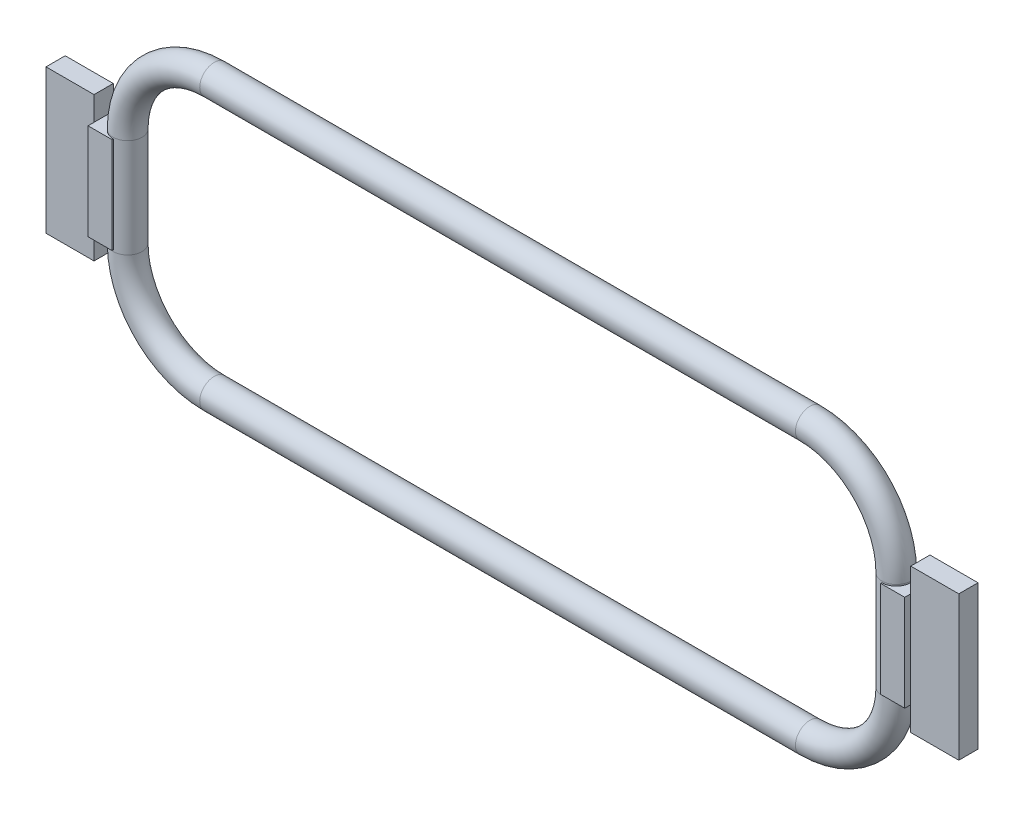
from build123d import *

# Parameters (mm, degrees)
SKETCH1_W           = 100
SKETCH1_H           = 75
SKETCH1_H_2         = 150
BOSS_EXTRUDE1_DEPTH = 20
SKETCH4_W           = 50
SKETCH4_H           = 150
BOSS_EXTRUDE3_DEPTH = 6.25
SKETCH5_W           = 50
SKETCH5_H           = 150
BOSS_EXTRUDE4_DEPTH = 6.25
SKETCH21_W          = 850
SKETCH21_H          = 32.5
CUT_EXTRUDE2_DEPTH  = 25
CUT_EXTRUDE3_START  = -150
SKETCH21_2_W        = 850
SKETCH21_2_H        = 32.5
CUT_EXTRUDE3_DEPTH  = 25
SWEEP1_PROFILE_R    = 15
CUT_EXTRUDE1_DEPTH  = 50


with BuildPart() as part:
    # Sketch1 → Boss-Extrude1 (new body)
    with BuildSketch(Plane.XY):
        with Locations((-850, 37.5)):
            Rectangle(SKETCH1_W, SKETCH1_H)
        with Locations((-850, -37.5)):
            Rectangle(SKETCH1_W, SKETCH1_H)
        Rectangle(SKETCH1_W, SKETCH1_H_2)
    extrude(amount=BOSS_EXTRUDE1_DEPTH)

    # Sketch4 → Boss-Extrude3 (add)
    with BuildSketch(Plane(origin=(0, 0, 0), x_dir=(-1, 0, 0), z_dir=(0, 0, -1))):
        with Locations((25, 0)):
            Rectangle(SKETCH4_W, SKETCH4_H)
        with Locations((825, 0)):
            Rectangle(SKETCH4_W, SKETCH4_H)
    extrude(amount=BOSS_EXTRUDE3_DEPTH)

    # Sketch5 → Boss-Extrude4 (add)
    with BuildSketch(Plane.XY.offset(20)):
        with Locations((-825, 0)):
            Rectangle(SKETCH5_W, SKETCH5_H)
        with Locations((-25, 0)):
            Rectangle(SKETCH5_W, SKETCH5_H)
    extrude(amount=BOSS_EXTRUDE4_DEPTH)

    # Sketch21 → Cut-Extrude2 (cut)
    with BuildSketch(Plane(origin=(0, 75, 0), x_dir=(1, 0, 0), z_dir=(0, 1, 0))):
        with Locations((-425, -10)):
            Rectangle(SKETCH21_W, SKETCH21_H)
    extrude(amount=-CUT_EXTRUDE2_DEPTH, mode=Mode.SUBTRACT)

    # Sketch21<2> → Cut-Extrude3 (cut)
    with BuildSketch(Plane(origin=(0, 75, 0), x_dir=(1, 0, 0), z_dir=(0, 1, 0)).offset(CUT_EXTRUDE3_START)):
        with Locations((-425, -10)):
            Rectangle(SKETCH21_2_W, SKETCH21_2_H)
    extrude(amount=CUT_EXTRUDE3_DEPTH, mode=Mode.SUBTRACT)

    # Sweep1: sweep along a path in Sketch6
    with BuildLine(Plane.XY.offset(10)) as sweep1_path:
        Line((-115, -141.504877042), (-735, -141.504877042))
        ThreePointArc((-735, -141.504877042), (-798.639610307, -115.144487349), (-825, -51.504877042))
        Line((-825, -51.504877042), (-825, 51.504877042))
        ThreePointArc((-825, 51.504877042), (-798.639610307, 115.144487349), (-735, 141.504877042))
        Line((-735, 141.504877042), (-115, 141.504877042))
        ThreePointArc((-115, 141.504877042), (-51.360389693, 115.144487349), (-25, 51.504877042))
        Line((-25, 51.504877042), (-25, -51.504877042))
        ThreePointArc((-25, -51.504877042), (-51.360389693, -115.144487349), (-115, -141.504877042))
    # Sweep1 profile (on start of the path) → Sweep1 (sweep)
    with BuildSketch(Plane(origin=(-115, -141.504877042, 10), x_dir=(0, 0, -1), z_dir=(-1, 0, 0))):
        Circle(SWEEP1_PROFILE_R)
    sweep(path=sweep1_path.line)

    # Sketch19 → Cut-Extrude1 (cut, symmetric)
    with BuildSketch(Plane(origin=(0, 0, 0), x_dir=(1, 0, 0), z_dir=(0, 1, 0))):
        with BuildLine():
            Line((-825, -26.25), (-825, -25))
            ThreePointArc((-825, -25), (-810, -10), (-825, 5))
            Line((-825, 5), (-825, 6.25))
            Line((-825, 6.25), (-800, 6.25))
            Line((-800, 6.25), (-800, -26.25))
            Line((-800, -26.25), (-825, -26.25))
        make_face()
        with BuildLine():
            Line((-50, -26.25), (-25, -26.25))
            Line((-25, -26.25), (-25, -25))
            ThreePointArc((-25, -25), (-40, -10), (-25, 5))
            Line((-25, 5), (-25, 6.25))
            Line((-25, 6.25), (-50, 6.25))
            Line((-50, 6.25), (-50, -26.25))
        make_face()
    extrude(amount=CUT_EXTRUDE1_DEPTH, both=True, mode=Mode.SUBTRACT)


solid = part.part
